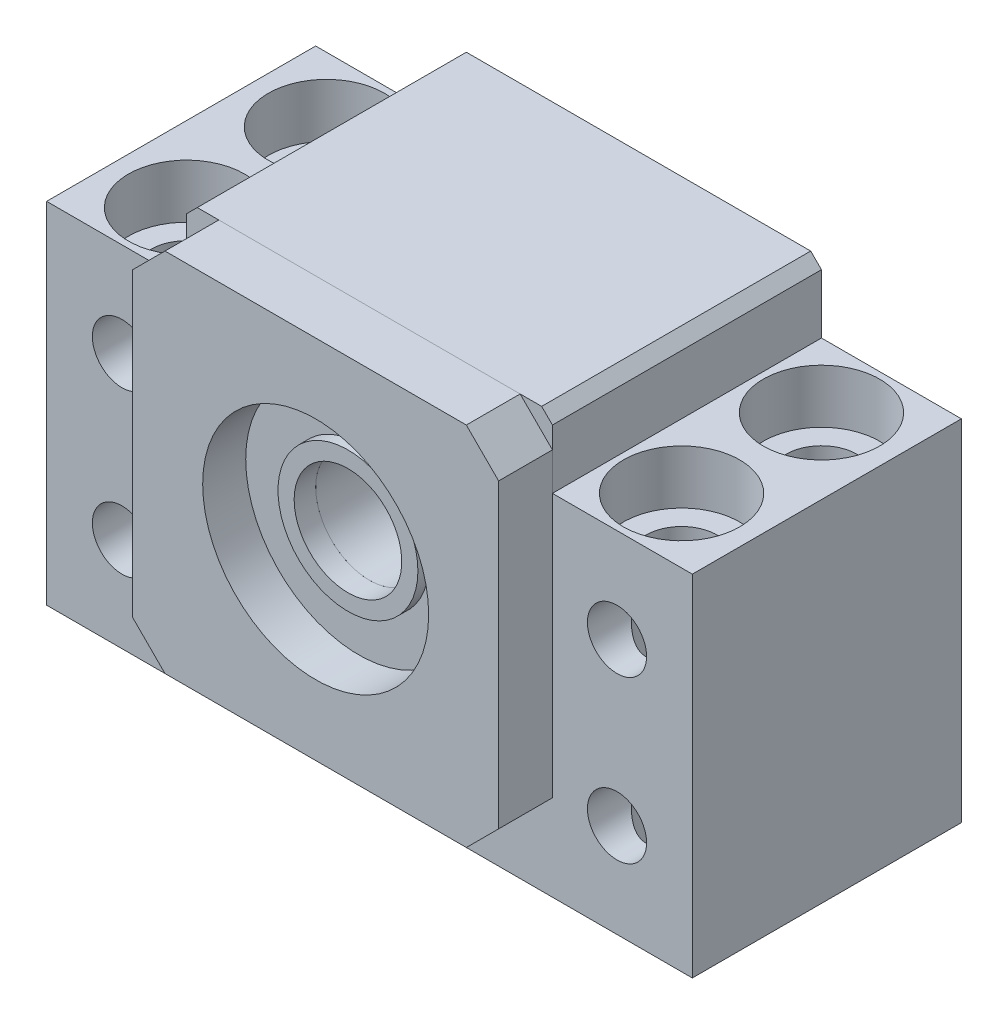
from build123d import *

# Parameters (mm, degrees)
AUFSATZ_LINEAR_AUSTRAGEN1_DEPTH = 25
AUFSATZ_LINEAR_AUSTRAGEN2_DEPTH = 5
SKIZZE3_R                       = 5
SCHNITT_LINEAR_AUSTRAGEN1_DEPTH = 50
SKIZZE4_R                       = 3.3
SCHNITT_LINEAR_AUSTRAGEN2_DEPTH = 50
SKIZZE5_R                       = 5.4
SCHNITT_LINEAR_AUSTRAGEN3_DEPTH = 5
SKIZZE6_R                       = 2.75
SCHNITT_LINEAR_AUSTRAGEN4_DEPTH = 50
SKIZZE7_R                       = 10.5
SCHNITT_LINEAR_AUSTRAGEN6_DEPTH = 3
SKIZZE8_R                       = 10.5
SKIZZE8_R_2                     = 6.5
SCHNITT_LINEAR_AUSTRAGEN7_DEPTH = 1.5
SCHNITT_LINEAR_START            = -1
SKIZZE9_R                       = 10.5
SKIZZE9_R_2                     = 6.5
SCHNITT_LINEAR_AUSTRAGEN8_DEPTH = 1


with BuildPart() as part:
    # Skizze1 → Aufsatz-Linear austragen1 (new body)
    with BuildSketch(Plane.XY):
        Polygon((-30, 0), (30, 0), (30, 32.5), (17, 32.5), (17, 38), (16, 39), (-16, 39), (-17, 38), (-17, 32.5), (-30, 32.5), align=None)
    extrude(amount=AUFSATZ_LINEAR_AUSTRAGEN1_DEPTH)


with BuildPart() as body_2:
    # Skizze2 → Aufsatz-Linear austragen2 (new body)
    with BuildSketch(Plane.XY.offset(25)):
        Polygon((-14, 39), (14, 39), (17, 36), (17, 8), (14, 5), (-14, 5), (-17, 8), (-17, 36), align=None)
    extrude(amount=AUFSATZ_LINEAR_AUSTRAGEN2_DEPTH)


with BuildPart() as schnitt_linear_austragen1_tool:
    # Skizze3 → Schnitt-Linear austragen1 (new body)
    with BuildSketch(Plane.XY.offset(30)):
        with Locations((0, 22)):
            Circle(SKIZZE3_R)
    extrude(amount=-SCHNITT_LINEAR_AUSTRAGEN1_DEPTH)


with BuildPart() as part_1:
    add(part.part)

    # Schnitt-Linear austragen1: cut by schnitt_linear_austragen1_tool
    add(schnitt_linear_austragen1_tool.part, mode=Mode.SUBTRACT)

    # Skizze4 → Schnitt-Linear austragen2 (cut)
    with BuildSketch(Plane(origin=(0, 32.5, 0), x_dir=(1, 0, 0), z_dir=(0, 1, 0))):
        with Locations(Location((23, -6, 0), (0, 0, 270))):
            Circle(SKIZZE4_R)
        with Locations(Location((23, -19, 0), (0, 0, 270))):
            Circle(SKIZZE4_R)
        with Locations(Location((-23, -6, 0), (0, 0, 270))):
            Circle(SKIZZE4_R)
        with Locations(Location((-23, -19, 0), (0, 0, 270))):
            Circle(SKIZZE4_R)
    extrude(amount=-SCHNITT_LINEAR_AUSTRAGEN2_DEPTH, mode=Mode.SUBTRACT)

    # Skizze5 → Schnitt-Linear austragen3 (cut)
    with BuildSketch(Plane(origin=(0, 32.5, 0), x_dir=(1, 0, 0), z_dir=(0, 1, 0))):
        with Locations(Location((23, -6, 0), (0, 0, 270))):
            Circle(SKIZZE5_R)
        with Locations(Location((23, -19, 0), (0, 0, 270))):
            Circle(SKIZZE5_R)
        with Locations(Location((-23, -19, 0), (0, 0, 90))):
            Circle(SKIZZE5_R)
        with Locations(Location((-23, -6, 0), (0, 0, 90))):
            Circle(SKIZZE5_R)
    extrude(amount=-SCHNITT_LINEAR_AUSTRAGEN3_DEPTH, mode=Mode.SUBTRACT)

    # Skizze6 → Schnitt-Linear austragen4 (cut)
    with BuildSketch(Plane.XY.offset(25)):
        with Locations((23, 23.75)):
            Circle(SKIZZE6_R)
        with Locations((23, 8.75)):
            Circle(SKIZZE6_R)
        with Locations((-23, 23.75)):
            Circle(SKIZZE6_R)
        with Locations((-23, 8.75)):
            Circle(SKIZZE6_R)
    extrude(amount=-SCHNITT_LINEAR_AUSTRAGEN4_DEPTH, mode=Mode.SUBTRACT)

    # Skizze8 → Schnitt-Linear austragen7 (cut)
    with BuildSketch(Plane(origin=(0, 0, 0), x_dir=(-1, 0, 0), z_dir=(0, 0, -1))):
        with Locations((0, 22)):
            Circle(SKIZZE8_R)
        with Locations((0, 22)):
            Circle(SKIZZE8_R_2, mode=Mode.SUBTRACT)
    extrude(amount=-SCHNITT_LINEAR_AUSTRAGEN7_DEPTH, mode=Mode.SUBTRACT)


with BuildPart() as body_2_1:
    add(body_2.part)

    # Schnitt-Linear austragen1: cut by schnitt_linear_austragen1_tool
    add(schnitt_linear_austragen1_tool.part, mode=Mode.SUBTRACT)

    # Skizze7 → Schnitt-Linear austragen6 (cut)
    with BuildSketch(Plane(origin=(0, 0, 30), x_dir=(-1, 0, 0), z_dir=(0, 0, -1))):
        with Locations((0, 22)):
            Circle(SKIZZE7_R)
    extrude(amount=SCHNITT_LINEAR_AUSTRAGEN6_DEPTH, mode=Mode.SUBTRACT)

    # Skizze9 → Schnitt-Linear austragen8 (cut)
    with BuildSketch(Plane.XY.offset(27).offset(SCHNITT_LINEAR_START)):
        with Locations((0, 22)):
            Circle(SKIZZE9_R)
        with Locations((0, 22)):
            Circle(SKIZZE9_R_2, mode=Mode.SUBTRACT)
    extrude(amount=SCHNITT_LINEAR_AUSTRAGEN8_DEPTH, mode=Mode.SUBTRACT)


solid = Compound([part_1.part, body_2_1.part])
